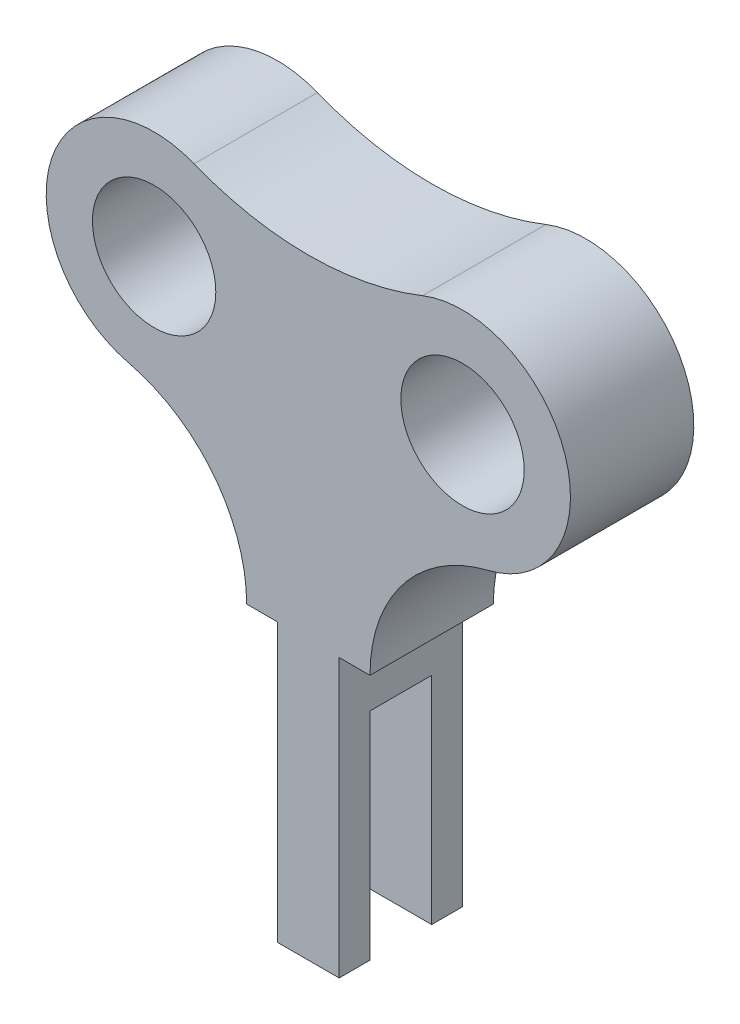
from build123d import *

# Parameters (mm, degrees)
SKETCH1_R           = 10
BOSS_EXTRUDE1_DEPTH = 20
SKETCH2_W           = 10
SKETCH2_H           = 35
CUT_EXTRUDE1_DEPTH  = 20


with BuildPart() as part:
    # Sketch1 → Boss-Extrude1 (new body)
    with BuildSketch(Plane.XY):
        with BuildLine():
            Line((-4.771193235, -41.306779105), (0.228806765, -41.306779105))
            Line((0.228806765, -41.306779105), (0.228806765, -86.306779105))
            Line((0.228806765, -86.306779105), (10.228806765, -86.306779105))
            Line((10.228806765, -86.306779105), (10.228806765, -41.306779105))
            Line((10.228806765, -41.306779105), (15.228806765, -41.306779105))
            ThreePointArc((15.228806765, -41.306779105), (20.581175565, -25.848105545), (34.346453824, -17.008673749))
            ThreePointArc((34.346453824, -17.008673749), (46.902822198, 5.31292851), (23.747325283, 16.255472857))
            ThreePointArc((23.747325283, 16.255472857), (5.228806765, 12.69968102), (-13.289711754, 16.255472857))
            ThreePointArc((-13.289711754, 16.255472857), (-36.445208668, 5.31292851), (-23.888840294, -17.008673749))
            ThreePointArc((-23.888840294, -17.008673749), (-10.123562035, -25.848105545), (-4.771193235, -41.306779105))
        make_face()
        with Locations((-19.771193235, 0)):
            Circle(SKETCH1_R, mode=Mode.SUBTRACT)
        with Locations((30.228806765, 0)):
            Circle(SKETCH1_R, mode=Mode.SUBTRACT)
    extrude(amount=BOSS_EXTRUDE1_DEPTH)

    # Sketch2 → Cut-Extrude1 (cut)
    with BuildSketch(Plane(origin=(10.228806765, 0, 0), x_dir=(0, 0, -1), z_dir=(1, 0, 0))):
        with Locations((-10, -68.806779105)):
            Rectangle(SKETCH2_W, SKETCH2_H)
    extrude(amount=-CUT_EXTRUDE1_DEPTH, mode=Mode.SUBTRACT)


solid = part.part
